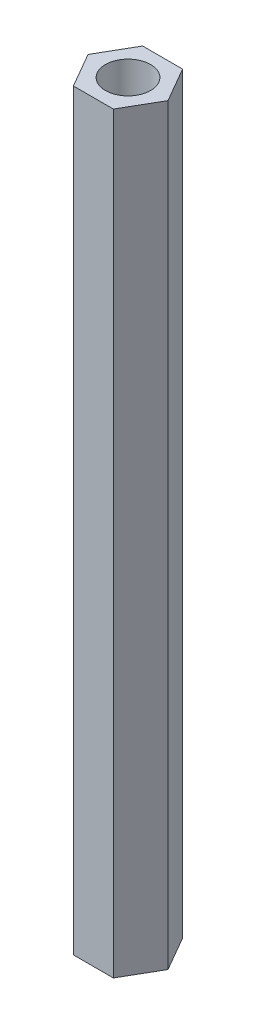
from build123d import *

# Parameters (mm, degrees)
BOSS_EXTRUDE1_DEPTH = 25
SKETCH2_R           = 1.5
CUT_EXTRUDE1_DEPTH  = 8
CUT_EXTRUDE2_START  = -8
SKETCH3_R           = 1.5
CUT_EXTRUDE2_DEPTH  = 8


with BuildPart() as part:
    # Sketch1 → Boss-Extrude1 (new, symmetric)
    with BuildSketch(Plane(origin=(0, 0, 0), x_dir=(1, 0, 0), z_dir=(0, 1, 0))):
        Polygon((2.655811238, 0), (1.327905619, 2.3), (-1.327905619, 2.3), (-2.655811238, 0), (-1.327905619, -2.3), (1.327905619, -2.3), align=None)
    extrude(amount=BOSS_EXTRUDE1_DEPTH, both=True)

    # Sketch2 → Cut-Extrude1 (cut)
    with BuildSketch(Plane(origin=(0, 25, 0), x_dir=(1, 0, 0), z_dir=(0, 1, 0))):
        with Locations(Location((0, 0, 0), (0, 0, 270))):
            Circle(SKETCH2_R)
    extrude(amount=-CUT_EXTRUDE1_DEPTH, mode=Mode.SUBTRACT)

    # Sketch3 → Cut-Extrude2 (cut)
    with BuildSketch(Plane.XZ.offset(25).offset(CUT_EXTRUDE2_START)):
        with Locations(Location((0, 0, 0), (0, 0, 90))):
            Circle(SKETCH3_R)
    extrude(amount=CUT_EXTRUDE2_DEPTH, mode=Mode.SUBTRACT)


solid = part.part
